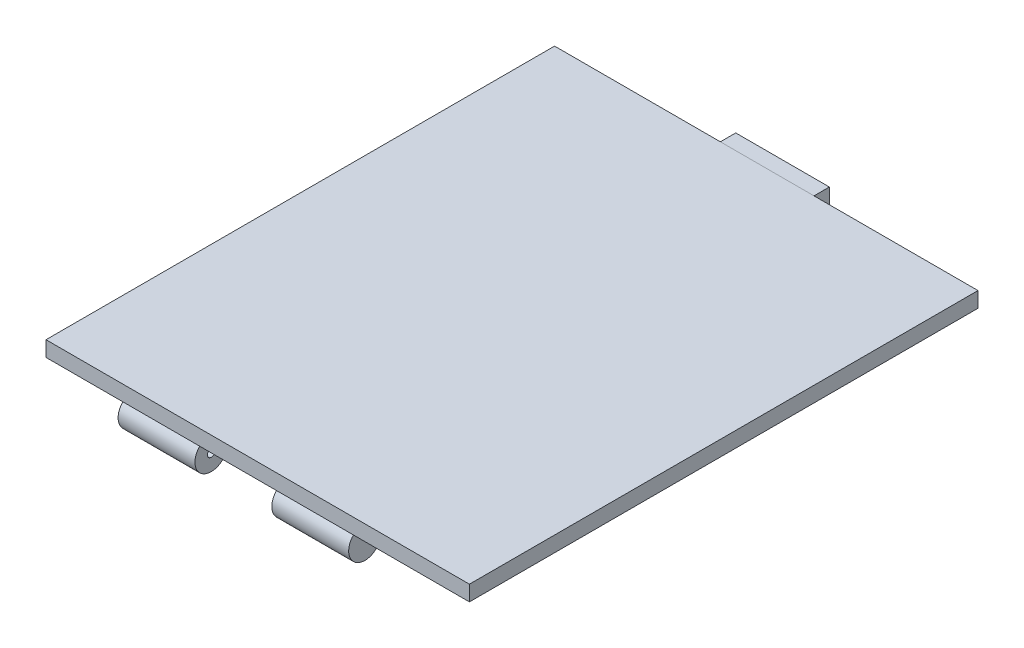
from build123d import *

# Parameters (mm, degrees)
SKETCH1_W               = 55.09
SKETCH1_H               = 66.17
BOSS_EXTRUDE1_DEPTH     = 2
SKETCH2_R               = 2.121320344
SKETCH2_R_2             = 0.5
BOSS_EXTRUDE2_DEPTH     = 10
SKETCH3_R               = 2.121320344
BOSS_EXTRUDE3_DEPTH     = 10
SKETCH4_W               = 12.184728623
SKETCH4_H               = 8.517734669
SKETCH4_W_2             = 9.974925384
SKETCH4_H_2             = 0.993258381
BOSS_EXTRUDE4_DEPTH     = 2
CUT_EXTRUDE1_DEPTH      = 76.014272697
CUT_EXTRUDE1_DEPTH_BACK = 76.014272697


with BuildPart() as part:
    # Sketch1 → Boss-Extrude1 (new body)
    with BuildSketch(Plane(origin=(0, 0, 0), x_dir=(1, 0, 0), z_dir=(0, 1, 0))):
        with Locations((27.545, -33.085)):
            Rectangle(SKETCH1_W, SKETCH1_H)
    extrude(amount=BOSS_EXTRUDE1_DEPTH)

    # Sketch2 → Boss-Extrude2 (add)
    with BuildSketch(Plane.ZY.offset(-10)):
        with Locations((64.67, -1.5)):
            Circle(SKETCH2_R)
        with Locations((64.67, -1.5)):
            Circle(SKETCH2_R_2, mode=Mode.SUBTRACT)
    extrude(amount=-BOSS_EXTRUDE2_DEPTH)

    # Sketch3 → Boss-Extrude3 (add)
    with BuildSketch(Plane.ZY.offset(-30)):
        with Locations((64.67, -1.5)):
            Circle(SKETCH3_R)
    extrude(amount=-BOSS_EXTRUDE3_DEPTH)


with BuildPart() as body_2:
    # Sketch4 → Boss-Extrude4 (new body)
    with BuildSketch(Plane(origin=(0, 0, 0), x_dir=(-1, 0, 0), z_dir=(0, 0, -1))):
        with Locations((-27.662522877, -2.258867335)):
            Rectangle(SKETCH4_W, SKETCH4_H)
        with Locations((-27.57912851, -4.996629191)):
            Rectangle(SKETCH4_W_2, SKETCH4_H_2, mode=Mode.SUBTRACT)
    extrude(amount=BOSS_EXTRUDE4_DEPTH)

    # Sketch6 → Cut-Extrude1 (cut, two sides: drawn at the far end of the back side and taken through both)
    with BuildSketch(Plane.ZY.offset(-21.570158565).offset(-CUT_EXTRUDE1_DEPTH_BACK)):
        Polygon((-2, -6.517734669), (0, -5.775216088), (0, -6.517734669), align=None)
    extrude(amount=CUT_EXTRUDE1_DEPTH + CUT_EXTRUDE1_DEPTH_BACK, mode=Mode.SUBTRACT)


solid = Compound([part.part, body_2.part])
